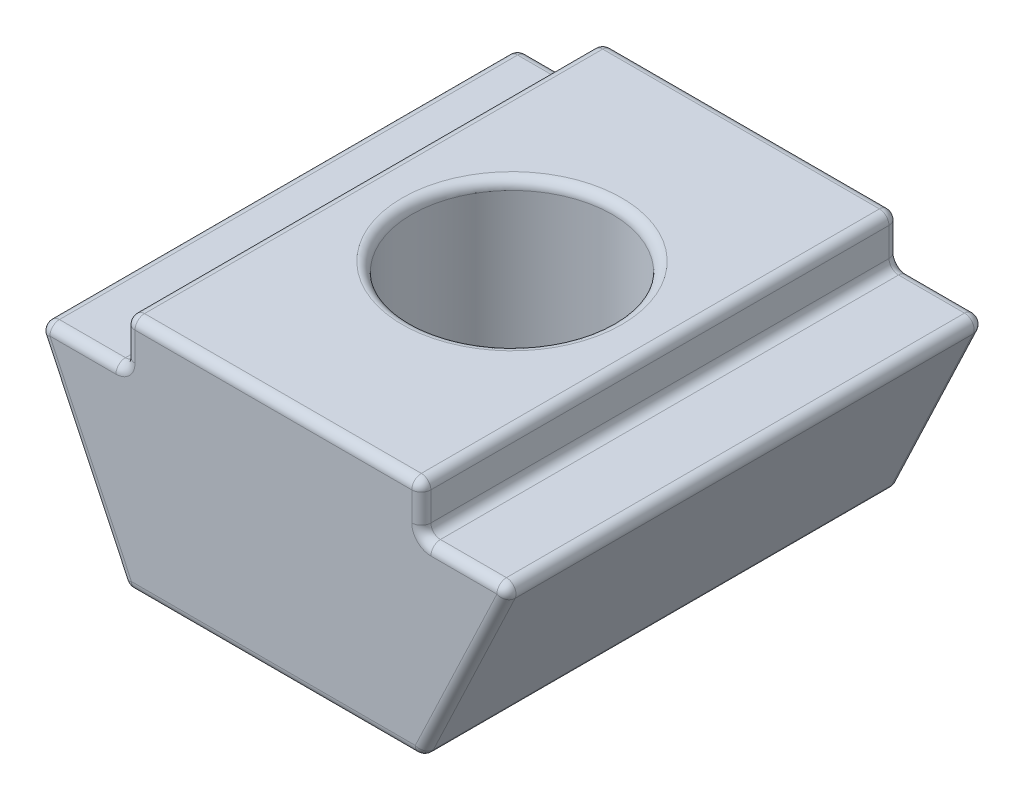
from build123d import *

# Parameters (mm, degrees)
NUTEXTRUSION_DEPTH    = 10
M5X0_8_TAPPED_HOLE1_D = 4.2
FILLET1_R             = 0.2


with BuildPart() as part:
    # MainSketch → NutExtrusion (new body)
    with BuildSketch(Plane.XY):
        Polygon((-3.1, 0), (3.1, 0), (5, 4), (3.1, 4), (3.1, 5), (-3.1, 5), (-3.1, 4), (-5, 4), align=None)
    extrude(amount=NUTEXTRUSION_DEPTH)

    # M5x0.8 Tapped Hole1 (through all)
    with Locations(Plane(origin=(0, 5, 0), x_dir=(1, 0, 0), z_dir=(0, 1, 0))):
        with Locations((0, -5)):
            Hole(M5X0_8_TAPPED_HOLE1_D / 2)

    # Fillet1
    fillet1_edges = [part.edges().sort_by_distance(p)[0] for p in [
        (4.05, 4, 0),
        (3.1, 4, 5),
        (3.1, 4.5, 0),
        (3.1, 5, 5),
        (0, 5, 0),
        (-3.1, 5, 5),
        (-3.1, 4.5, 0),
        (2.1, 5, 5),
        (2.1, 0, 5),
        (-3.1, 4, 5),
        (-4.05, 4, 0),
        (-5, 4, 5),
        (-4.05, 2, 0),
        (-3.1, 0, 5),
        (0, 0, 0),
        (0, 0, 10),
        (4.05, 2, 10),
        (4.05, 4, 10),
        (3.1, 4.5, 10),
        (0, 5, 10),
        (-3.1, 4.5, 10),
        (-4.05, 4, 10),
        (-4.05, 2, 10),
        (3.1, 0, 5),
        (4.05, 2, 0),
        (5, 4, 5),
    ]]
    fillet(fillet1_edges, radius=FILLET1_R)


solid = part.part
